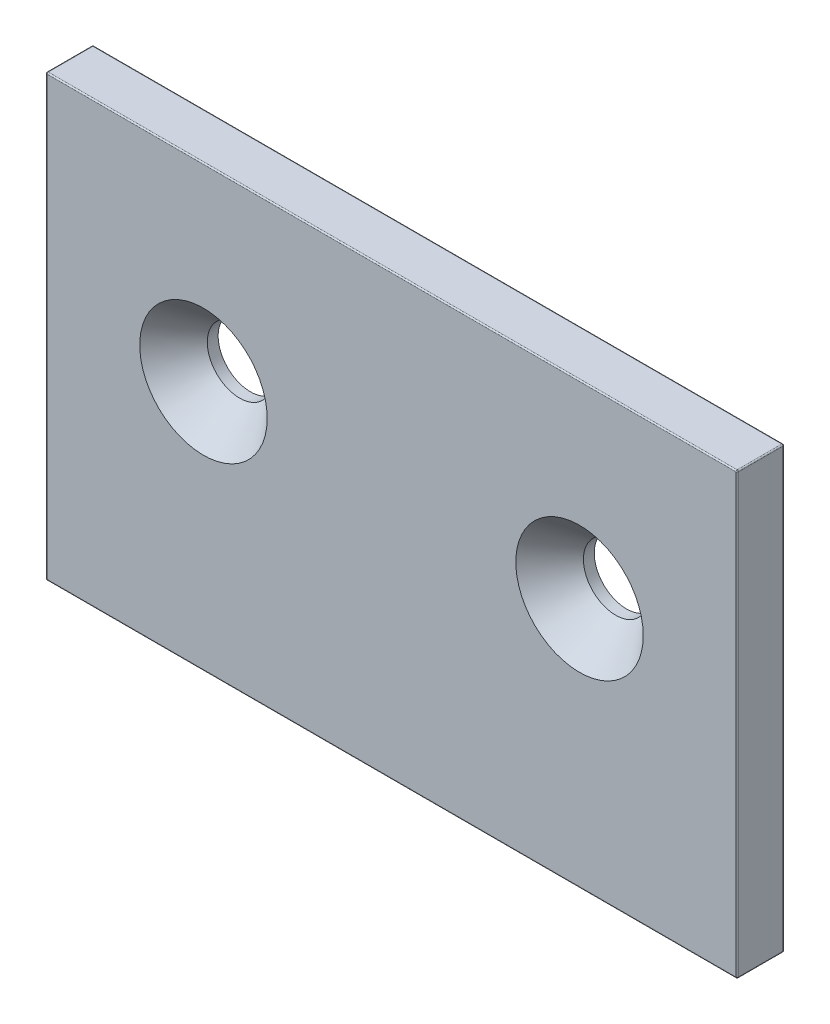
from build123d import *

# Parameters (mm, degrees)
SKETCH1_W           = 69.85
SKETCH1_H           = 44.45
BOSS_EXTRUDE1_DEPTH = 2.3749
FILLET1_R           = 0.127


with BuildPart() as part:
    # Sketch1 → Boss-Extrude1 (new, symmetric)
    with BuildSketch(Plane.XY):
        with Locations((0, 22.225)):
            Rectangle(SKETCH1_W, SKETCH1_H)
    extrude(amount=BOSS_EXTRUDE1_DEPTH, both=True)

    # Sketch4 → CSK for 1/4 Flat Head Machine Screw2 (revolve, cut)
    with BuildSketch(Plane(origin=(18.998712013, 25.315105776, 2.3749), x_dir=(0, -1, 0), z_dir=(1, 0, 0))):
        Polygon((0, 0), (0, 4.7498), (3.2639, 4.7498), (3.2639, 3.652419693), (6.4389, 0), align=None)
    csk_for_1_4_flat_head_machine_screw2 = revolve(axis=Axis((18.998712013, 25.315105776, 8.7249), (0, 0, -1)), mode=Mode.SUBTRACT)

    # Mirror1: CSK for 1/4 Flat Head Machine Screw2 across plane
    add(csk_for_1_4_flat_head_machine_screw2.mirror(Plane(origin=(0, 0, 0), x_dir=(0, 0, 1), z_dir=(1, 0, 0))), mode=Mode.SUBTRACT)

    # Fillet1
    fillet1_edges = [part.edges().sort_by_distance(p)[0] for p in [
        (34.925, 22.225, 2.3749),
        (0, 44.45, 2.3749),
        (-34.925, 22.225, 2.3749),
        (0, 44.45, -2.3749),
        (34.925, 22.225, -2.3749),
        (0, 0, -2.3749),
        (-34.925, 22.225, -2.3749),
        (0, 0, 2.3749),
        (-34.925, 44.45, 0),
        (34.925, 44.45, 0),
        (34.925, 0, 0),
        (-34.925, 0, 0),
    ]]
    fillet(fillet1_edges, radius=FILLET1_R)


solid = part.part
